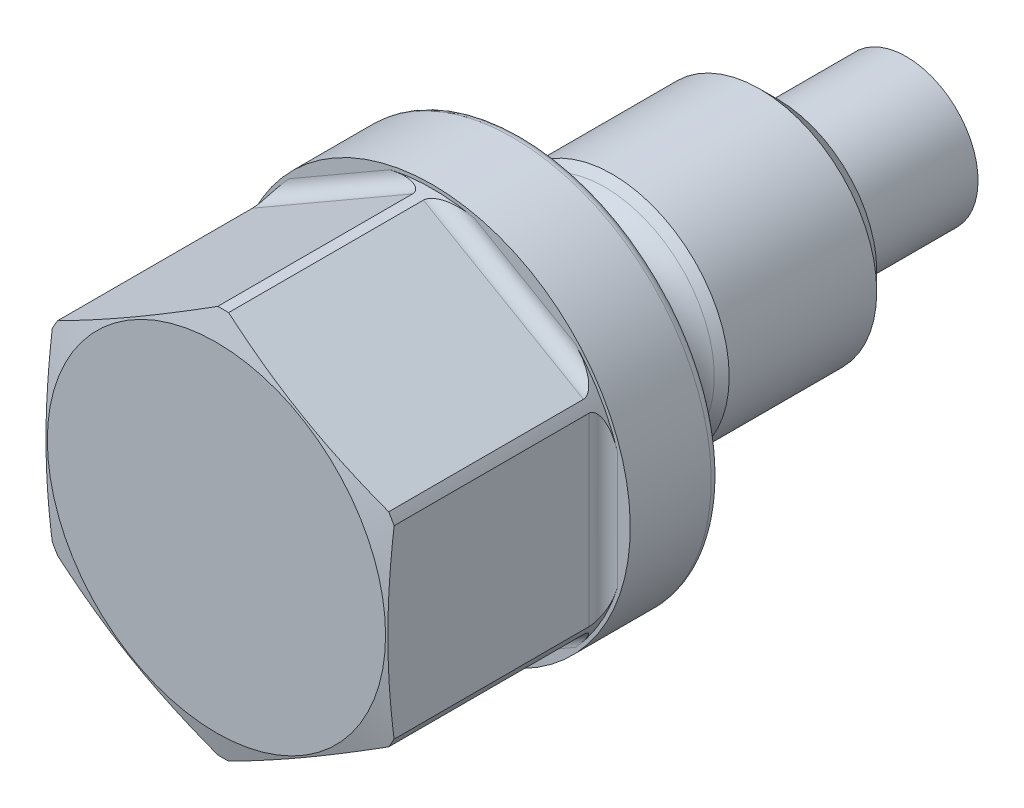
from build123d import *

# Parameters (mm, degrees)
SKETCH2_R          = 12.258164927
CUT_EXTRUDE1_DEPTH = 12
FILLET3_R          = 0.8
FILLET6_R          = 0.8
FILLET7_R          = 0.8


with BuildPart() as part:
    # Sketch1 → Revolve1 (revolve)
    with BuildSketch(Plane(origin=(0, 0, 0), x_dir=(0, 0, -1), z_dir=(1, 0, 0))):
        with BuildLine():
            Line((0, 0), (0, 2.85))
            Line((0, 2.85), (-0.655292556, 3.985))
            Line((-0.655292556, 3.985), (-7.4, 3.985))
            ThreePointArc((-7.4, 3.985), (-7.682842712, 4.102157288), (-7.8, 4.385))
            Line((-7.8, 4.385), (-7.8, 5.5))
            Line((-7.8, 5.5), (-8.8, 6.5))
            Line((-8.8, 6.5), (-17, 6.5))
            Line((-17, 6.5), (-17.414213562, 6.085786438))
            ThreePointArc((-17.414213562, 6.085786438), (-18.06306026, 5.652240935), (-18.828427125, 5.5))
            Line((-18.828427125, 5.5), (-21.2, 5.5))
            ThreePointArc((-21.2, 5.5), (-21.765685425, 5.734314575), (-22, 6.3))
            Line((-22, 6.3), (-22, 10.5))
            ThreePointArc((-22, 10.5), (-22.146446609, 10.853553391), (-22.5, 11))
            Line((-22.5, 11), (-27, 11))
            Line((-27, 11), (-27, 10.8))
            Line((-27, 10.8), (-38.624871131, 10.8))
            Line((-38.624871131, 10.8), (-39, 9.4))
            Line((-39, 9.4), (-39, 0))
            Line((-39, 0), (0, 0))
        make_face()
    revolve(axis=Axis((0, 0, 0), (0, 0, 1)))

    # Sketch2 → Cut-Extrude1 (cut)
    with BuildSketch(Plane.XY.offset(39)):
        Circle(SKETCH2_R)
        Polygon((0, -10.969655115), (9.5, -5.484827557), (9.5, 5.484827557), (0, 10.969655115), (-9.5, 5.484827557), (-9.5, -5.484827557), align=None, mode=Mode.SUBTRACT)
    extrude(amount=-CUT_EXTRUDE1_DEPTH, mode=Mode.SUBTRACT)

    # Fillet3
    fillet3_edges = [part.edges().sort_by_distance(p)[0] for p in [
        (4.75, 8.227241336, 27),
        (-4.75, -8.227241336, 27),
    ]]
    fillet(fillet3_edges, radius=FILLET3_R)

    # Fillet6
    fillet6_edges = [part.edges().sort_by_distance(p)[0] for p in [
        (4.75, -8.227241336, 27),
        (-4.75, 8.227241336, 27),
    ]]
    fillet(fillet6_edges, radius=FILLET6_R)

    # Fillet7
    fillet7_edges = [part.edges().sort_by_distance(p)[0] for p in [
        (9.5, 0, 27),
        (-9.5, 0, 27),
    ]]
    fillet(fillet7_edges, radius=FILLET7_R)


solid = part.part
